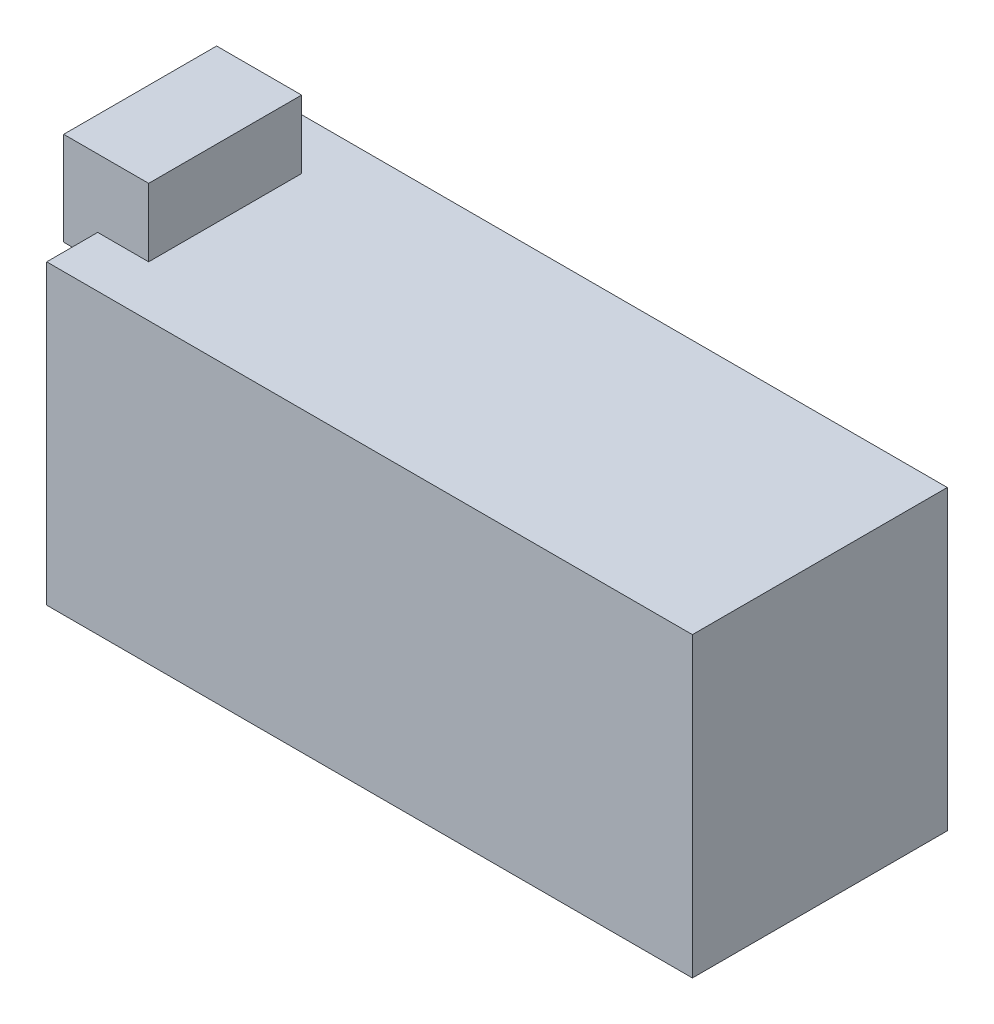
from build123d import *

# Parameters (mm, degrees)
SKETCH1_W                = 76
SKETCH1_H                = 35
BOSS_EXTRUDE1_DEPTH      = 30
BOSS_EXTRUDE2_DEPTH      = 8
BOSS_EXTRUDE2_DEPTH_BACK = 3
SKETCH2_W                = 10
SKETCH2_H                = 18


with BuildPart() as part:
    # Sketch1 → Boss-Extrude1 (new body)
    with BuildSketch(Plane.XY):
        Rectangle(SKETCH1_W, SKETCH1_H)
    extrude(amount=BOSS_EXTRUDE1_DEPTH)

    # Sketch2 → Boss-Extrude2 (add, two sides: drawn at the far end of the back side and taken through both)
    with BuildSketch(Plane(origin=(0, 17.5, 0), x_dir=(1, 0, 0), z_dir=(0, 1, 0)).offset(-BOSS_EXTRUDE2_DEPTH_BACK)):
        with Locations((-37, -15)):
            Rectangle(SKETCH2_W, SKETCH2_H)
    extrude(amount=BOSS_EXTRUDE2_DEPTH + BOSS_EXTRUDE2_DEPTH_BACK)


solid = part.part
